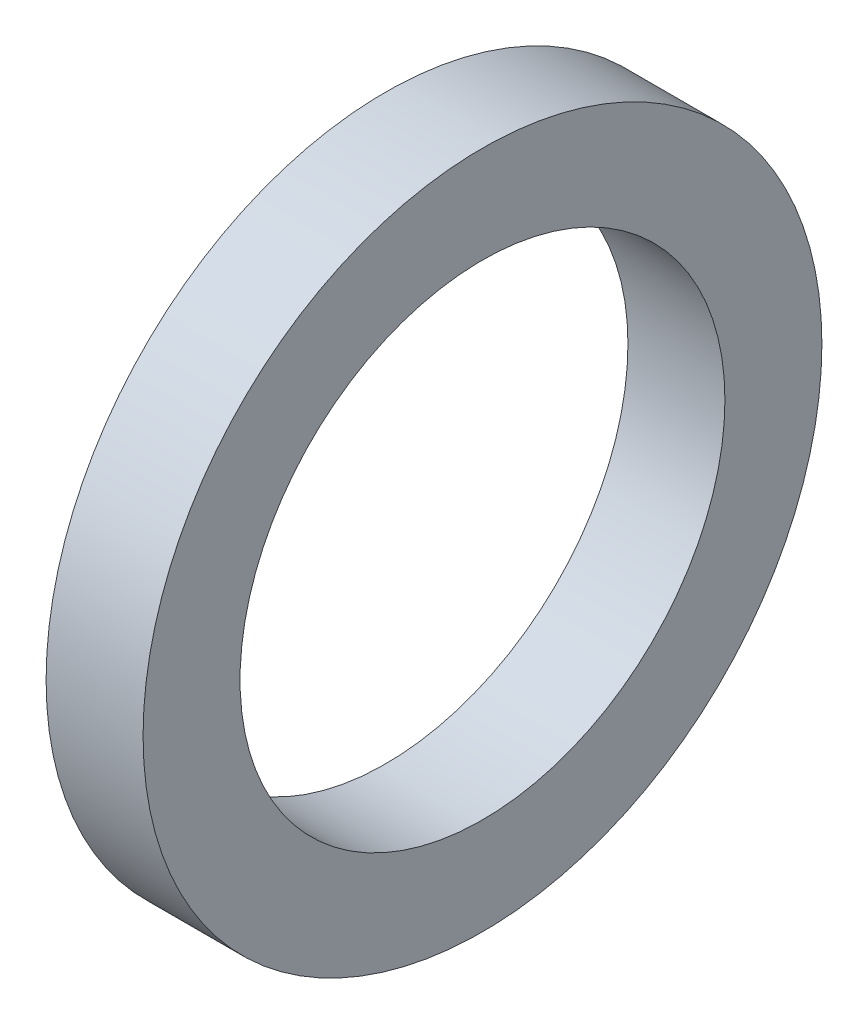
from build123d import *

# Parameters (mm, degrees)
SKETCH1_R           = 11.1125
SKETCH1_R_2         = 7.9375
BOSS_EXTRUDE1_DEPTH = 3.175


with BuildPart() as part:
    # Sketch1 → Boss-Extrude1 (new body)
    with BuildSketch(Plane(origin=(0, 0, 0), x_dir=(0, 0, -1), z_dir=(1, 0, 0))):
        Circle(SKETCH1_R)
        Circle(SKETCH1_R_2, mode=Mode.SUBTRACT)
    extrude(amount=BOSS_EXTRUDE1_DEPTH)


solid = part.part
